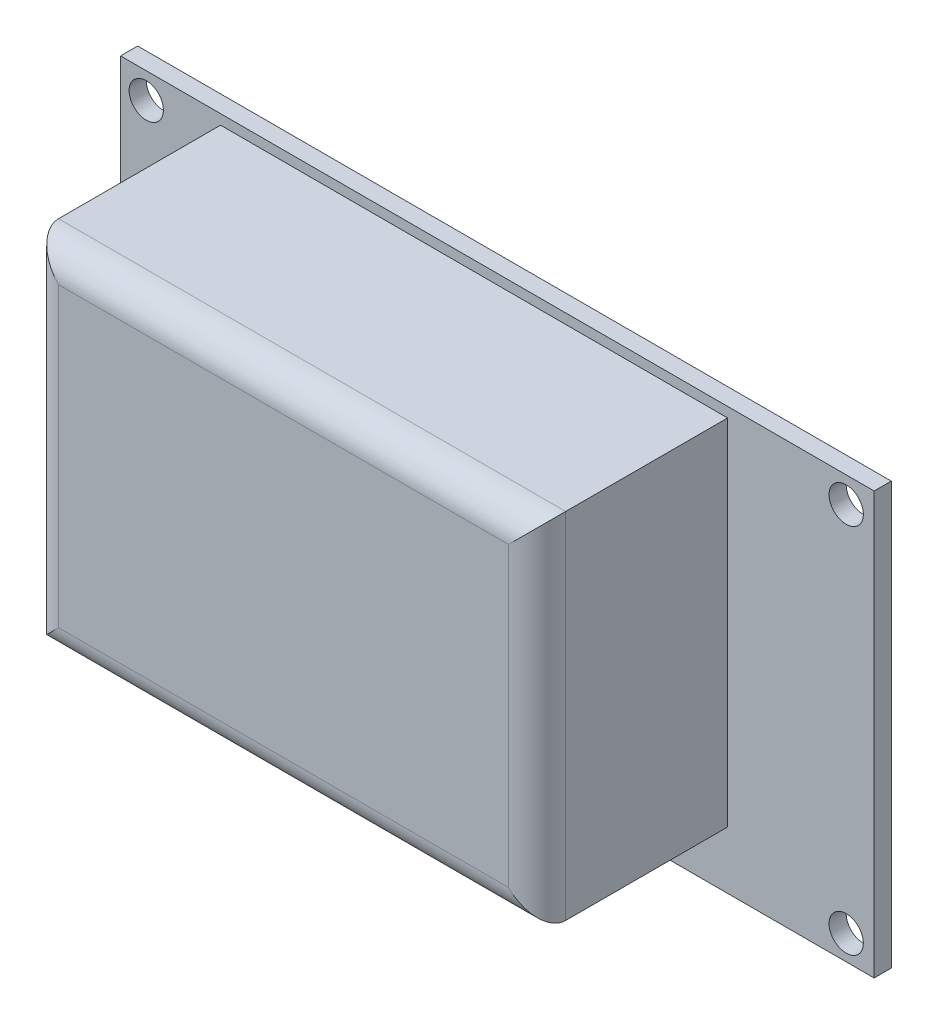
from build123d import *

# Parameters (mm, degrees)
SKETCH1_W           = 67.00000001
SKETCH1_H           = 37.49999993
BOSS_EXTRUDE1_DEPTH = 1.524
SKETCH2_W           = 45.085000006
SKETCH2_H           = 31.496000001
BOSS_EXTRUDE2_DEPTH = 16.9418
HOLE1_D             = 3.048
HOLE2_D             = 3.048
HOLE2_DEPTH         = 18.4658
HOLE3_D             = 3.048
HOLE3_DEPTH         = 18.4658
HOLE4_D             = 3.048
HOLE4_DEPTH         = 18.4658
FILLET1_R           = 2.54


with BuildPart() as part:
    # Sketch1 → Boss-Extrude1 (new body)
    with BuildSketch(Plane(origin=(0, 0, 0), x_dir=(-1, 0, 0), z_dir=(0, 0, -1))):
        Rectangle(SKETCH1_W, SKETCH1_H)
    extrude(amount=-BOSS_EXTRUDE1_DEPTH)

    # Sketch2 → Boss-Extrude2 (add)
    with BuildSketch(Plane.XY.offset(1.524)):
        with Locations((-2.067500005, 2.112999961)):
            Rectangle(SKETCH2_W, SKETCH2_H)
    extrude(amount=BOSS_EXTRUDE2_DEPTH)

    # Hole1 (through all)
    with Locations(Plane.XY.offset(1.524)):
        with Locations((31.015999995, -16.556000035)):
            Hole(HOLE1_D / 2)

    # Hole2
    with Locations(Plane(origin=(0, 0, 0), x_dir=(-1, 0, 0), z_dir=(0, 0, -1))):
        with Locations((31.214000005, -16.556000035)):
            Hole(HOLE2_D / 2, depth=HOLE2_DEPTH)

    # Hole3
    with Locations(Plane(origin=(0, 0, 0), x_dir=(-1, 0, 0), z_dir=(0, 0, -1))):
        with Locations((-31.015999995, 16.463999965)):
            Hole(HOLE3_D / 2, depth=HOLE3_DEPTH)

    # Hole4
    with Locations(Plane(origin=(0, 0, 0), x_dir=(-1, 0, 0), z_dir=(0, 0, -1))):
        with Locations((31.214000005, 16.463999965)):
            Hole(HOLE4_D / 2, depth=HOLE4_DEPTH)

    # Fillet1
    fillet1_edges = [part.edges().sort_by_distance(p)[0] for p in [
        (20.474999998, 2.112999962, 18.4658),
        (-2.067500005, 17.860999962, 18.4658),
        (-24.610000008, 2.112999962, 18.4658),
        (-2.067500005, -13.635000039, 18.4658),
    ]]
    fillet(fillet1_edges, radius=FILLET1_R)


solid = part.part
